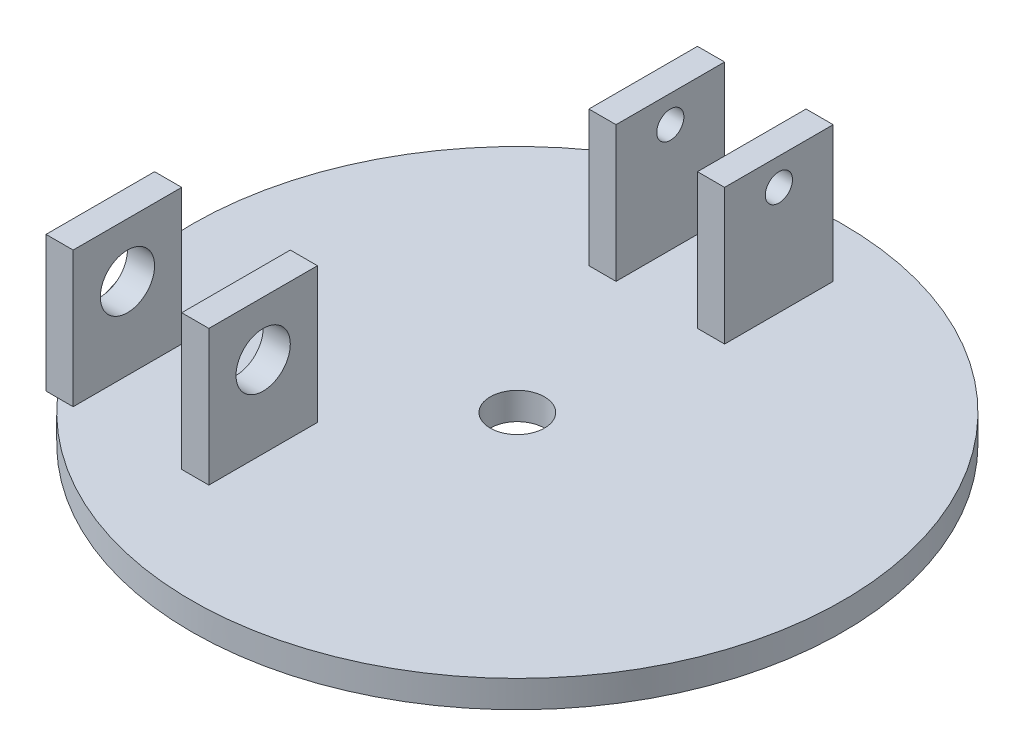
from build123d import *

# Parameters (mm, degrees)
SKETCH1_R           = 76.2
BOSS_EXTRUDE1_DEPTH = 6.35
SKETCH2_R           = 6.35
CUT_EXTRUDE1_DEPTH  = 108.95
SKETCH3_W           = 6.35
SKETCH3_H           = 25.4
BOSS_EXTRUDE2_DEPTH = 31.75
CUT_EXTRUDE2_REACH  = 131.524
SKETCH4_R           = 6.35
SKETCH5_W           = 6.35
SKETCH5_H           = 25.4
BOSS_EXTRUDE3_DEPTH = 31.75
CUT_EXTRUDE3_REACH  = 131.524
SKETCH6_R           = 3.175


with BuildPart() as part:
    # Sketch1 → Boss-Extrude1 (new body)
    with BuildSketch(Plane(origin=(0, 0, 0), x_dir=(1, 0, 0), z_dir=(0, 1, 0))):
        with Locations(Location((0, 0, 0), (0, 0, 270))):
            Circle(SKETCH1_R)
    extrude(amount=BOSS_EXTRUDE1_DEPTH)

    # Sketch2 → Cut-Extrude1 (cut, through all)
    with BuildSketch(Plane.XZ):
        with Locations(Location((0, 0, 0), (0, 0, 270))):
            Circle(SKETCH2_R)
    extrude(amount=-CUT_EXTRUDE1_DEPTH, mode=Mode.SUBTRACT)

    # Sketch3 → Boss-Extrude2 (add)
    with BuildSketch(Plane(origin=(0, 6.35, 0), x_dir=(1, 0, 0), z_dir=(0, 1, 0))):
        with Locations((-56.28767, -38.1)):
            Rectangle(SKETCH3_W, SKETCH3_H)
        with Locations((-24.53767, -38.1)):
            Rectangle(SKETCH3_W, SKETCH3_H)
    extrude(amount=BOSS_EXTRUDE2_DEPTH)

    # Cut-Extrude2: up to this face of the body (flat: up to its plane)
    cut_extrude2_end = Plane(part.part.faces().sort_by_distance((-59.46267, 22.225, 38.1))[0])
    # Sketch4 → Cut-Extrude2 (cut, up to the picked face)
    with BuildSketch(Plane(origin=(-21.36267, 0, 0), x_dir=(0, 0, -1), z_dir=(1, 0, 0)), mode=Mode.PRIVATE) as cut_extrude2_sk1:
        with Locations((-38.1, 25.4)):
            Circle(SKETCH4_R)
    cut_extrude2_tool1 = split(extrude(cut_extrude2_sk1.sketch, amount=-CUT_EXTRUDE2_REACH, mode=Mode.PRIVATE), bisect_by=cut_extrude2_end, keep=Keep.BOTH, mode=Mode.PRIVATE)
    add(cut_extrude2_tool1.solids().sort_by(Axis((-21.36267, 25.4, 38.1), (-1, 0, 0)))[0], mode=Mode.SUBTRACT)

    # Sketch5 → Boss-Extrude3 (add)
    with BuildSketch(Plane(origin=(0, 6.35, 0), x_dir=(1, 0, 0), z_dir=(0, 1, 0))):
        with Locations((-18.18767, 50.8)):
            Rectangle(SKETCH5_W, SKETCH5_H)
        with Locations((7.21233, 50.8)):
            Rectangle(SKETCH5_W, SKETCH5_H)
    extrude(amount=BOSS_EXTRUDE3_DEPTH)

    # Cut-Extrude3: up to this face of the body (flat: up to its plane)
    cut_extrude3_end = Plane(part.part.faces().sort_by_distance((10.38733, 22.225, -50.8))[0])
    # Sketch6 → Cut-Extrude3 (cut, up to the picked face)
    with BuildSketch(Plane.ZY.offset(21.36267), mode=Mode.PRIVATE) as cut_extrude3_sk1:
        with Locations((-50.8, 31.75)):
            Circle(SKETCH6_R)
    cut_extrude3_tool1 = split(extrude(cut_extrude3_sk1.sketch, amount=-CUT_EXTRUDE3_REACH, mode=Mode.PRIVATE), bisect_by=cut_extrude3_end, keep=Keep.BOTH, mode=Mode.PRIVATE)
    add(cut_extrude3_tool1.solids().sort_by(Axis((-21.36267, 31.75, -50.8), (1, 0, 0)))[0], mode=Mode.SUBTRACT)


solid = part.part
